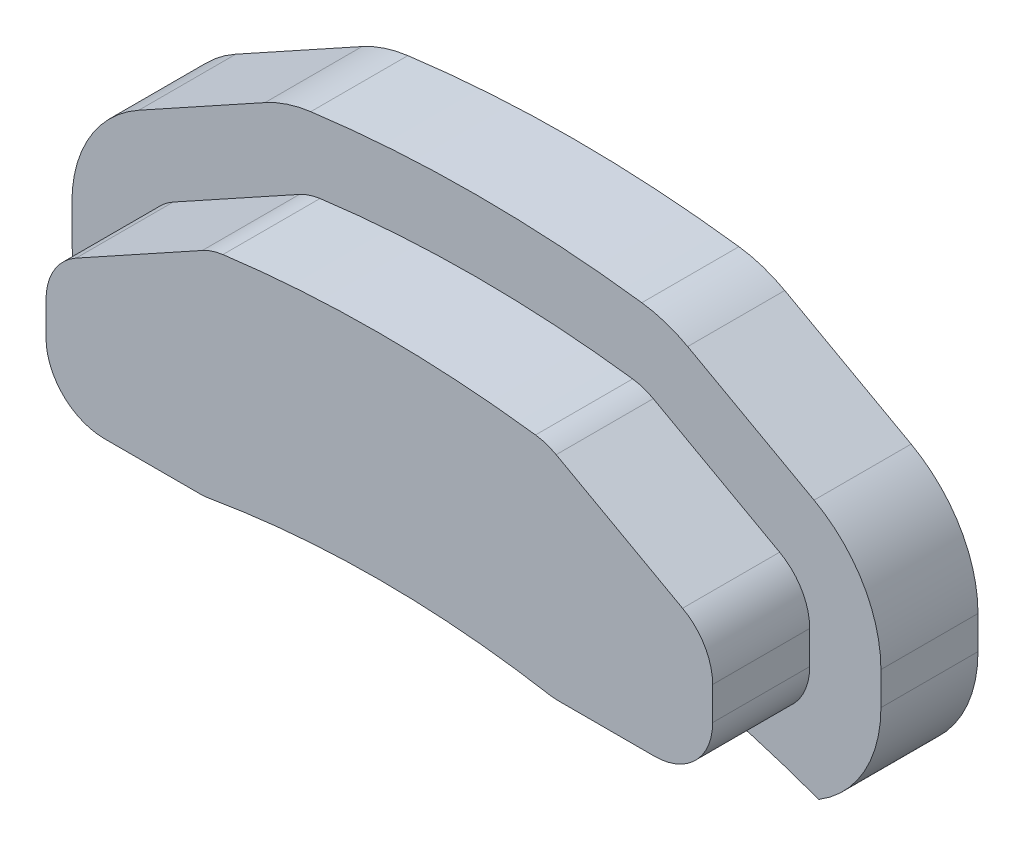
from build123d import *

# Parameters (mm, degrees)
BOSS_EXTRUDE1_DEPTH = 5
BOSS_EXTRUDE2_DEPTH = 3
BOSS_EXTRUDE3_DEPTH = 1


with BuildPart() as part:
    # Sketch1 → Boss-Extrude1 (new body)
    with BuildSketch(Plane.XY):
        with BuildLine():
            Line((-5.475833864, 36.750373078), (-9.376960794, 34.595435627))
            ThreePointArc((-9.376960794, 34.595435627), (-10.056879686, 33.934547755), (-10.306619263, 33.019838718))
            Line((-10.306619263, 33.019838718), (-10.306619263, 31.999976553))
            ThreePointArc((-10.306619263, 31.999976553), (-9.779411469, 30.727184347), (-8.506619263, 30.199976553))
            Line((-8.506619263, 30.199976553), (-5.552402581, 30.199976553))
            ThreePointArc((-5.552402581, 30.199976553), (-5.398466912, 30.206570907), (-5.245659139, 30.226305653))
            ThreePointArc((-5.245659139, 30.226305653), (-2.637016879, 30.563008221), (-0.009120041, 30.674996011))
            ThreePointArc((-0.009120041, 30.674996011), (2.618776796, 30.563008221), (5.227419056, 30.226305653))
            ThreePointArc((5.227419056, 30.226305653), (5.380226829, 30.206570907), (5.534162498, 30.199976553))
            Line((5.534162498, 30.199976553), (8.493548715, 30.199976553))
            ThreePointArc((8.493548715, 30.199976553), (9.766340921, 30.727184347), (10.293548715, 31.999976553))
            Line((10.293548715, 31.999976553), (10.293548715, 33.019838718))
            ThreePointArc((10.293548715, 33.019838718), (10.043809137, 33.934547755), (9.363890246, 34.595435627))
            Line((9.363890246, 34.595435627), (5.458712815, 36.752610527))
            ThreePointArc((5.458712815, 36.752610527), (5.14978717, 36.887221852), (4.821185066, 36.961893934))
            ThreePointArc((4.821185066, 36.961893934), (-0.009071369, 37.274996263), (-4.839174836, 36.959542957))
            ThreePointArc((-4.839174836, 36.959542957), (-5.167324404, 36.884847724), (-5.475833864, 36.750373078))
        make_face()
    extrude(amount=BOSS_EXTRUDE1_DEPTH)

    # Sketch2 → Boss-Extrude2 (add)
    with BuildSketch(Plane(origin=(0, 0, 0), x_dir=(-1, 0, 0), z_dir=(0, 0, -1))):
        with BuildLine():
            ThreePointArc((10.587505912, 28.583851445), (11.993992673, 30.040837277), (12.506619263, 31.999976553))
            Line((12.506619263, 31.999976553), (12.506619263, 33.019838718))
            ThreePointArc((12.506619263, 33.019838718), (11.951642425, 35.052525467), (10.440711554, 36.521165182))
            Line((10.440711554, 36.521165182), (6.539584624, 38.676102633))
            ThreePointArc((6.539584624, 38.676102633), (5.854008048, 38.97493518), (5.124786785, 39.140924586))
            ThreePointArc((5.124786785, 39.140924586), (0.009606768, 39.474996197), (-5.105735244, 39.143414321))
            ThreePointArc((-5.105735244, 39.143414321), (-5.835962142, 38.97747636), (-6.522463575, 38.678340082))
            Line((-6.522463575, 38.678340082), (-10.427641006, 36.521165182))
            ThreePointArc((-10.427641006, 36.521165182), (-11.938571876, 35.052525467), (-12.493548715, 33.019838718))
            Line((-12.493548715, 33.019838718), (-12.493548715, 31.999976553))
            ThreePointArc((-12.493548715, 31.999976553), (-11.980256235, 30.039652429), (-10.57211338, 28.582438121))
            ThreePointArc((-10.57211338, 28.582438121), (-5.36535689, 29.998971577), (0.009611281, 30.474993977))
            ThreePointArc((0.009611281, 30.474993977), (5.382569695, 29.999329411), (10.587505912, 28.583851445))
        make_face()
        with BuildLine():
            ThreePointArc((-5.227419056, 30.226305653), (-5.380226829, 30.206570907), (-5.534162498, 30.199976553))
            Line((-5.534162498, 30.199976553), (-8.493548715, 30.199976553))
            ThreePointArc((-8.493548715, 30.199976553), (-9.766340921, 30.727184347), (-10.293548715, 31.999976553))
            Line((-10.293548715, 31.999976553), (-10.293548715, 33.019838718))
            ThreePointArc((-10.293548715, 33.019838718), (-10.043809137, 33.934547755), (-9.363890246, 34.595435627))
            Line((-9.363890246, 34.595435627), (-5.458712815, 36.752610527))
            ThreePointArc((-5.458712815, 36.752610527), (-5.14978717, 36.887221852), (-4.821185066, 36.961893934))
            ThreePointArc((-4.821185066, 36.961893934), (0.009071369, 37.274996263), (4.839174836, 36.959542957))
            ThreePointArc((4.839174836, 36.959542957), (5.167324404, 36.884847724), (5.475833864, 36.750373078))
            Line((5.475833864, 36.750373078), (9.376960794, 34.595435627))
            ThreePointArc((9.376960794, 34.595435627), (10.056879686, 33.934547755), (10.306619263, 33.019838718))
            Line((10.306619263, 33.019838718), (10.306619263, 31.999976553))
            ThreePointArc((10.306619263, 31.999976553), (9.779411469, 30.727184347), (8.506619263, 30.199976553))
            Line((8.506619263, 30.199976553), (5.552402581, 30.199976553))
            ThreePointArc((5.552402581, 30.199976553), (5.398466912, 30.206570907), (5.245659139, 30.226305653))
            ThreePointArc((5.245659139, 30.226305653), (2.637016879, 30.563008221), (0.009120041, 30.674996011))
            ThreePointArc((0.009120041, 30.674996011), (-2.618776796, 30.563008221), (-5.227419056, 30.226305653))
        make_face(mode=Mode.SUBTRACT)
    extrude(amount=-BOSS_EXTRUDE2_DEPTH)

    # Sketch6 → Boss-Extrude3 (add)
    with BuildSketch(Plane.XY.offset(5)):
        with BuildLine():
            Line((-5.475833864, 36.750373078), (-9.376960794, 34.595435627))
            ThreePointArc((-9.376960794, 34.595435627), (-10.056879686, 33.934547755), (-10.306619263, 33.019838718))
            Line((-10.306619263, 33.019838718), (-10.306619263, 31.999976553))
            ThreePointArc((-10.306619263, 31.999976553), (-9.779411469, 30.727184347), (-8.506619263, 30.199976553))
            Line((-8.506619263, 30.199976553), (-5.552402581, 30.199976553))
            ThreePointArc((-5.552402581, 30.199976553), (-5.398466912, 30.206570907), (-5.245659139, 30.226305653))
            ThreePointArc((-5.245659139, 30.226305653), (-2.637016879, 30.563008221), (-0.009120041, 30.674996011))
            ThreePointArc((-0.009120041, 30.674996011), (2.618776796, 30.563008221), (5.227419056, 30.226305653))
            ThreePointArc((5.227419056, 30.226305653), (5.380226829, 30.206570907), (5.534162498, 30.199976553))
            Line((5.534162498, 30.199976553), (8.493548715, 30.199976553))
            ThreePointArc((8.493548715, 30.199976553), (9.766340921, 30.727184347), (10.293548715, 31.999976553))
            Line((10.293548715, 31.999976553), (10.293548715, 33.019838718))
            ThreePointArc((10.293548715, 33.019838718), (10.043809137, 33.934547755), (9.363890246, 34.595435627))
            Line((9.363890246, 34.595435627), (5.458712815, 36.752610527))
            ThreePointArc((5.458712815, 36.752610527), (5.14978717, 36.887221852), (4.821185066, 36.961893934))
            ThreePointArc((4.821185066, 36.961893934), (-0.009071369, 37.274996263), (-4.839174836, 36.959542957))
            ThreePointArc((-4.839174836, 36.959542957), (-5.167324404, 36.884847724), (-5.475833864, 36.750373078))
        make_face()
    extrude(amount=BOSS_EXTRUDE3_DEPTH)


solid = part.part
